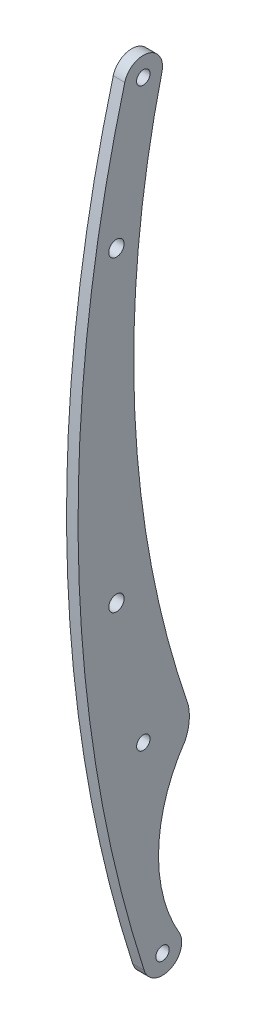
from build123d import *

# Parameters (mm, degrees)
CROQUIS1_R              = 1.75
CROQUIS1_R_2            = 2
SALIENTE_EXTRUIR1_DEPTH = 3


with BuildPart() as part:
    # Croquis1 → Saliente-Extruir1 (new body)
    with BuildSketch(Plane(origin=(0, 0, 0), x_dir=(0, 0, -1), z_dir=(1, 0, 0))):
        with BuildLine():
            ThreePointArc((0.225128417, -51.483442404), (6.890995422, -54.628621427), (9.447658726, -47.71563316))
            ThreePointArc((9.447658726, -47.71563316), (3.98237778, -26.07129422), (10.967929509, -4.868729021))
            ThreePointArc((10.967929509, -4.868729021), (11.945328824, -1.144167506), (11.692718634, 2.698208841))
            ThreePointArc((11.692718634, 2.698208841), (-2.21241308, 75.268149846), (4.858559991, 148.819155042))
            ThreePointArc((4.858559991, 148.819155042), (1.234772605, 154.845135355), (-4.831112169, 151.288547713))
            ThreePointArc((-4.831112169, 151.288547713), (-16.879167042, 49.539087028), (0.225128417, -51.483442404))
        make_face()
        with Locations((5, -50)):
            Circle(CROQUIS1_R, mode=Mode.SUBTRACT)
        with Locations((0, 150)):
            Circle(CROQUIS1_R, mode=Mode.SUBTRACT)
        Circle(CROQUIS1_R, mode=Mode.SUBTRACT)
        with Locations((-7, 35)):
            Circle(CROQUIS1_R_2, mode=Mode.SUBTRACT)
        with Locations((-7, 115)):
            Circle(CROQUIS1_R_2, mode=Mode.SUBTRACT)
    extrude(amount=SALIENTE_EXTRUIR1_DEPTH)


solid = part.part
